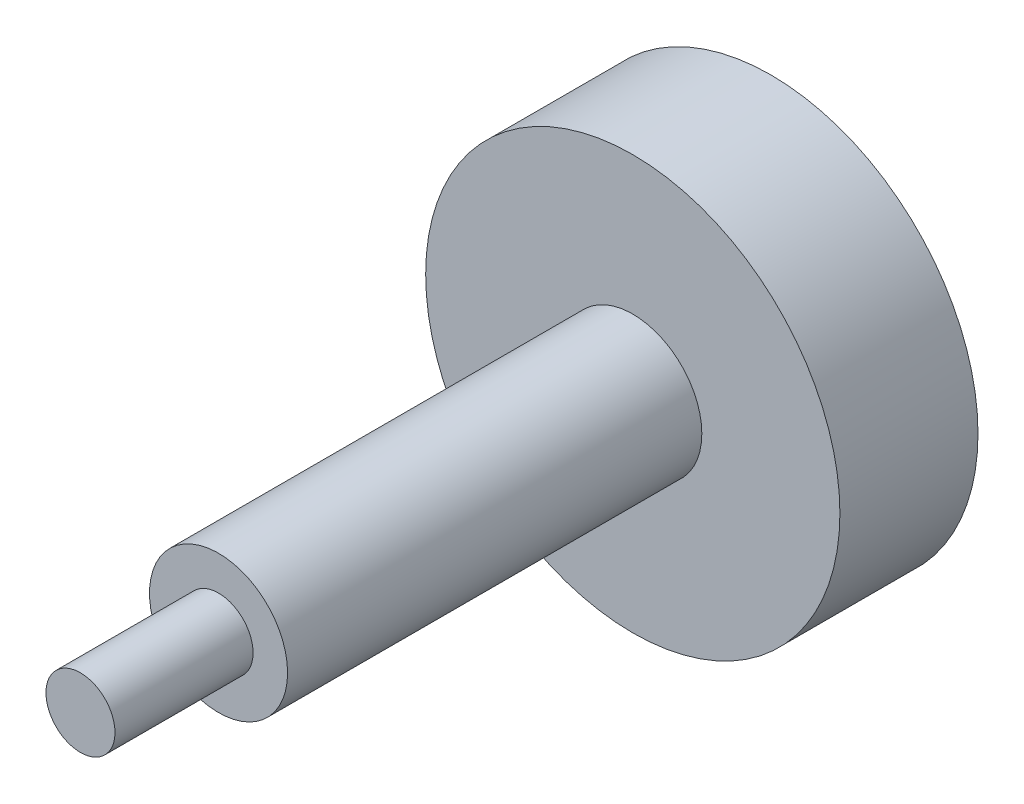
from build123d import *

# Parameters (mm, degrees)
SKETCH1_R           = 300
BOSS_EXTRUDE1_DEPTH = 200
SKETCH2_R           = 100
BOSS_EXTRUDE2_DEPTH = 600
SKETCH3_R           = 50
BOSS_EXTRUDE3_DEPTH = 200


with BuildPart() as part:
    # Sketch1 → Boss-Extrude1 (new body)
    with BuildSketch(Plane.XY):
        Circle(SKETCH1_R)
    extrude(amount=BOSS_EXTRUDE1_DEPTH)

    # Sketch2 → Boss-Extrude2 (add)
    with BuildSketch(Plane.XY.offset(200)):
        Circle(SKETCH2_R)
    extrude(amount=BOSS_EXTRUDE2_DEPTH)

    # Sketch3 → Boss-Extrude3 (add)
    with BuildSketch(Plane.XY.offset(800)):
        Circle(SKETCH3_R)
    extrude(amount=BOSS_EXTRUDE3_DEPTH)


solid = part.part
